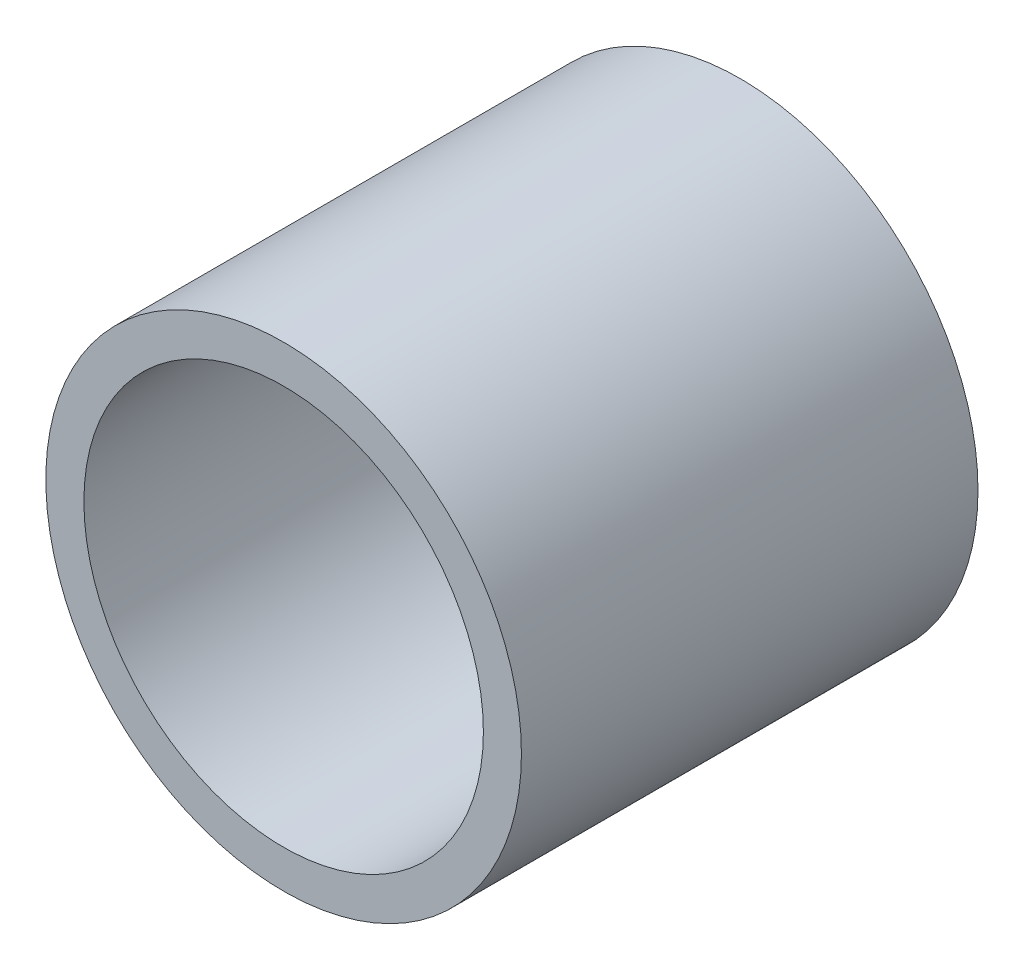
from build123d import *

# Parameters (mm, degrees)
SKETCH1_R           = 1.25
BOSS_EXTRUDE1_DEPTH = 2.4
SKETCH2_R           = 1.05
CUT_EXTRUDE1_DEPTH  = 2


with BuildPart() as part:
    # Sketch1 → Boss-Extrude1 (new body)
    with BuildSketch(Plane.XY):
        Circle(SKETCH1_R)
    extrude(amount=BOSS_EXTRUDE1_DEPTH)

    # Sketch2 → Cut-Extrude1 (cut)
    with BuildSketch(Plane.XY.offset(2.4)):
        Circle(SKETCH2_R)
    extrude(amount=-CUT_EXTRUDE1_DEPTH, mode=Mode.SUBTRACT)


solid = part.part
